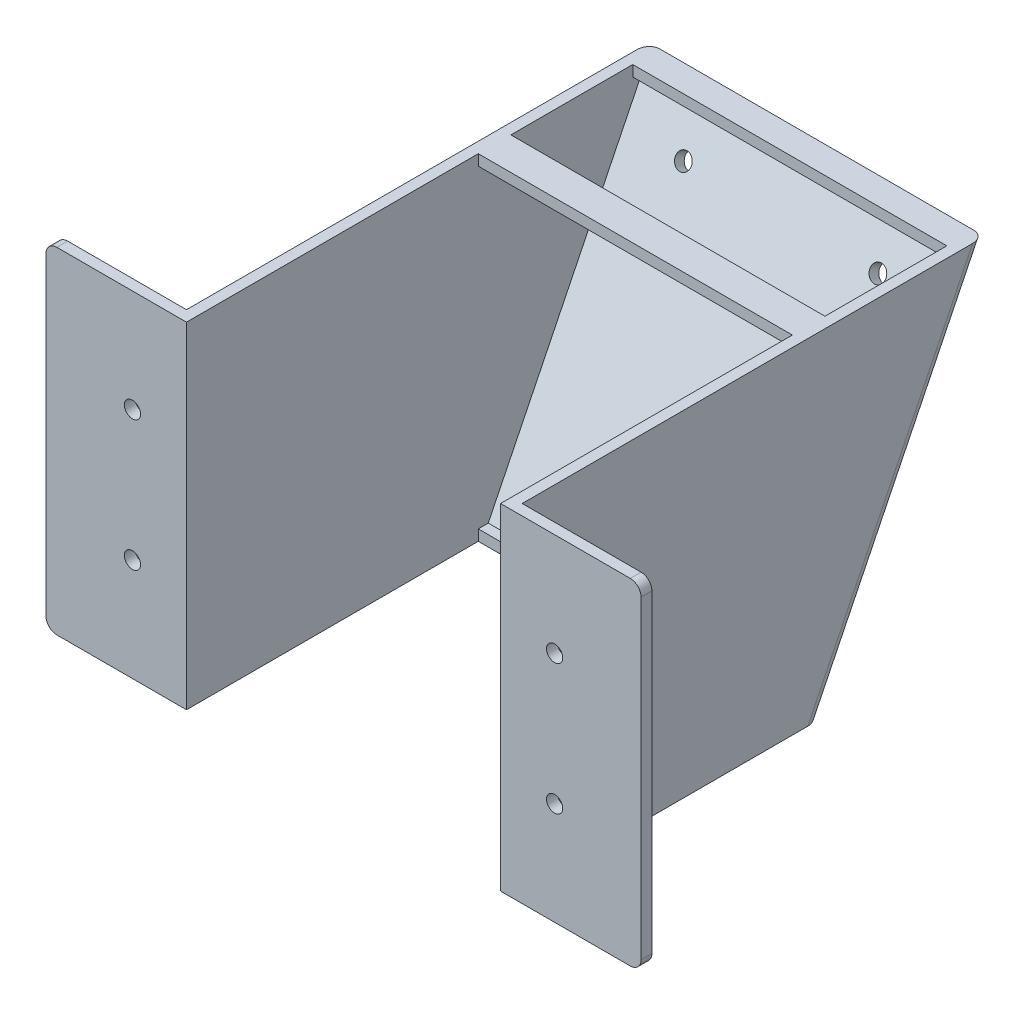
from build123d import *

# Parameters (mm, degrees)
SKETCH_1_W           = 62.126713746
SKETCH_1_H           = 62.126713746
EXTRUDE_1_DEPTH      = 57
SKETCH_3_W           = 58.126713746
SKETCH_3_H           = 62.126713746
CUT_EXTRUDE_5_DEPTH  = 54
SKETCH_4_W           = 2
SKETCH_4_H           = 62.126713746
EXTRUDE_2_DEPTH      = 24
SKETCH_5_W           = 2
SKETCH_5_H           = 62.126713746
EXTRUDE_3_DEPTH      = 24
SKETCH_6_R           = 1.5
CUT_EXTRUDE_6_DEPTH  = 24
SKETCH_7_R           = 1.5
CUT_EXTRUDE_7_DEPTH  = 24
FILLET_3_R           = 2
FILLET_4_R           = 2
FILLET_5_R           = 2
FILLET_6_R           = 2
SKETCH_1_2_W         = 62.126713746
SKETCH_1_2_H         = 62.126713746
EXTRUDE_4_DEPTH      = 30.59
CUT_EXTRUDE_8_DEPTH  = 70
SKETCH_12_R          = 1.5
CUT_EXTRUDE_9_DEPTH  = 10
CUT_EXTRUDE_10_REACH = 108.26
SKETCH_15_W          = 58.126713746
SKETCH_15_H          = 22.559791582
CUT_EXTRUDE_11_DEPTH = 2
FILLET_7_R           = 2
FILLET_8_R           = 2


with BuildPart() as part:
    # 草图1 → 凸台-拉伸1 (new body)
    with BuildSketch(Plane.XY):
        Rectangle(SKETCH_1_W, SKETCH_1_H)
    extrude(amount=EXTRUDE_1_DEPTH)

    # 草图3 → 切除-拉伸5 (cut)
    with BuildSketch(Plane.XY.offset(57)):
        Rectangle(SKETCH_3_W, SKETCH_3_H)
    extrude(amount=-CUT_EXTRUDE_5_DEPTH, mode=Mode.SUBTRACT)

    # 草图4 → 凸台-拉伸2 (add)
    with BuildSketch(Plane(origin=(31.063356873, 0, 0), x_dir=(0, 0, -1), z_dir=(1, 0, 0))):
        with Locations((-56, 0)):
            Rectangle(SKETCH_4_W, SKETCH_4_H)
    extrude(amount=EXTRUDE_2_DEPTH)

    # 草图5 → 凸台-拉伸3 (add)
    with BuildSketch(Plane.ZY.offset(31.063356873)):
        with Locations((56, 0)):
            Rectangle(SKETCH_5_W, SKETCH_5_H)
    extrude(amount=EXTRUDE_3_DEPTH)

    # 草图6 → 切除-拉伸6 (cut)
    with BuildSketch(Plane.XY.offset(57)):
        with Locations((39.063356873, 12.063356873)):
            Circle(SKETCH_6_R)
        with Locations(Location((-39.063356873, 12.063356873, 0), (0, 0, 270))):
            Circle(SKETCH_6_R)
        with Locations(Location((39.063356873, -12.063356873, 0), (0, 0, 270))):
            Circle(SKETCH_6_R)
        with Locations((-39.063356873, -12.063356873)):
            Circle(SKETCH_6_R)
    extrude(amount=-CUT_EXTRUDE_6_DEPTH, mode=Mode.SUBTRACT)

    # 草图7 → 切除-拉伸7 (cut)
    with BuildSketch(Plane(origin=(0, 0, 0), x_dir=(-1, 0, 0), z_dir=(0, 0, -1))):
        with Locations((-18, 24)):
            Circle(SKETCH_7_R)
        with Locations((18, 24)):
            Circle(SKETCH_7_R)
        with Locations((18, -24)):
            Circle(SKETCH_7_R)
        with Locations((-18, -24)):
            Circle(SKETCH_7_R)
    extrude(amount=-CUT_EXTRUDE_7_DEPTH, mode=Mode.SUBTRACT)

    # 圆角3
    fillet_3_edges = [part.edges().sort_by_distance(p)[0] for p in [
        (55.063356873, -31.063356873, 56),
    ]]
    fillet(fillet_3_edges, radius=FILLET_3_R)

    # 圆角4
    fillet_4_edges = [part.edges().sort_by_distance(p)[0] for p in [
        (55.063356873, 31.063356873, 56),
    ]]
    fillet(fillet_4_edges, radius=FILLET_4_R)

    # 圆角5
    fillet_5_edges = [part.edges().sort_by_distance(p)[0] for p in [
        (-55.063356873, -31.063356873, 56),
    ]]
    fillet(fillet_5_edges, radius=FILLET_5_R)

    # 圆角6
    fillet_6_edges = [part.edges().sort_by_distance(p)[0] for p in [
        (-55.063356873, 31.063356873, 56),
    ]]
    fillet(fillet_6_edges, radius=FILLET_6_R)

    # 草图1<2> → 凸台-拉伸4 (add)
    with BuildSketch(Plane.XY):
        Rectangle(SKETCH_1_2_W, SKETCH_1_2_H)
    extrude(amount=-EXTRUDE_4_DEPTH)

    # 草图11 → 切除-拉伸8 (cut)
    with BuildSketch(Plane(origin=(31.063356873, 0, 0), x_dir=(0, 0, -1), z_dir=(1, 0, 0))):
        Polygon((30.59, 31.063356873), (0, -31.256692995), (30.59, -31.063356873), align=None)
    extrude(amount=-CUT_EXTRUDE_8_DEPTH, mode=Mode.SUBTRACT)

    # 草图12 → 切除-拉伸9 (cut)
    with BuildSketch(Plane(origin=(0, -6.068714237, -12.363601631), x_dir=(-1, 0, 0), z_dir=(0, -0.440632808345781, -0.8976874334696406))):
        with Locations(Location((18, -17.761485842, 0), (0, 0, 90))):
            Circle(SKETCH_12_R)
        with Locations(Location((-18, -17.761485842, 0), (0, 0, 270))):
            Circle(SKETCH_12_R)
        with Locations(Location((18, 30.238514158, 0), (0, 0, 90))):
            Circle(SKETCH_12_R)
        with Locations(Location((-18, 30.238514158, 0), (0, 0, 270))):
            Circle(SKETCH_12_R)
    extrude(amount=-CUT_EXTRUDE_9_DEPTH, mode=Mode.SUBTRACT)

    # 切除-拉伸10: up to this face of the body (flat: up to its plane)
    cut_extrude_10_end = Plane(part.part.faces().sort_by_distance((-29.063356873, 0, 30))[0])
    # 草图14 → 切除-拉伸10 (cut, up to the picked face)
    with BuildSketch(Plane.ZY.offset(-29.063356873), mode=Mode.PRIVATE) as cut_extrude_10_sk1:
        Polygon((3, -29.063356873), (3, 29.063356873), (-27.380346496, 29.063356873), (1.151340775, -29.063356873), align=None)
    cut_extrude_10_tool1 = split(extrude(cut_extrude_10_sk1.sketch, amount=CUT_EXTRUDE_10_REACH, mode=Mode.PRIVATE), bisect_by=cut_extrude_10_end, keep=Keep.BOTH, mode=Mode.PRIVATE)
    add(cut_extrude_10_tool1.solids().sort_by(Axis((29.063357, 8.576401, -7.162129), (-1, 0, 0)))[0], mode=Mode.SUBTRACT)

    # 草图15 → 切除-拉伸11 (cut)
    with BuildSketch(Plane(origin=(0, 31.063356873, 0), x_dir=(1, 0, 0), z_dir=(0, 1, 0))):
        with Locations((0, 14.310104209)):
            Rectangle(SKETCH_15_W, SKETCH_15_H)
    extrude(amount=-CUT_EXTRUDE_11_DEPTH, mode=Mode.SUBTRACT)

    # 圆角7
    fillet_7_edges = [part.edges().sort_by_distance(p)[0] for p in [
        (-31.063356873, 0, -15.342449833),
    ]]
    fillet(fillet_7_edges, radius=FILLET_7_R)

    # 圆角8
    fillet_8_edges = [part.edges().sort_by_distance(p)[0] for p in [
        (31.063356873, 0, -15.342449833),
    ]]
    fillet(fillet_8_edges, radius=FILLET_8_R)


solid = part.part
